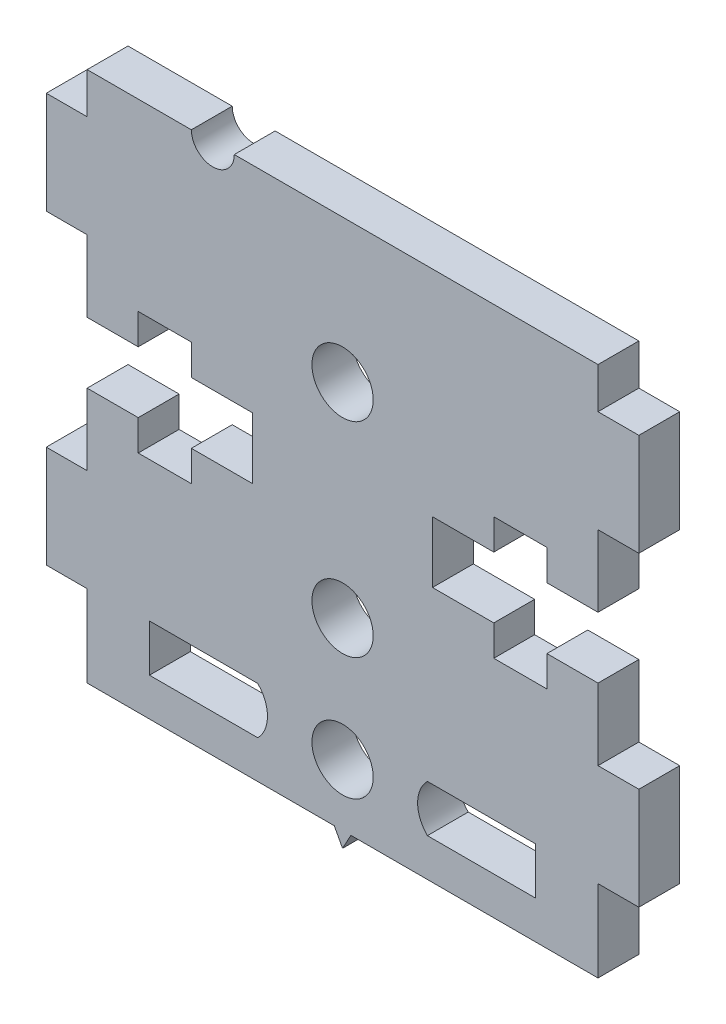
from build123d import *

# Parameters (mm, degrees)
SKETCH_1_R      = 1.5
EXTRUDE_1_DEPTH = 2


with BuildPart() as part:
    # 草图1 → 凸台-拉伸1 (new body)
    with BuildSketch(Plane.XY):
        with BuildLine():
            Line((-8.682938962, -11.200971973), (-10.682938962, -11.200971973))
            Line((-10.682938962, -11.200971973), (-10.682938962, -6.200971973))
            Line((-10.682938962, -6.200971973), (-8.682938962, -6.200971973))
            Line((-8.682938962, -6.200971973), (-8.682938962, -2.700971973))
            Line((-8.682938962, -2.700971973), (-6.182938962, -2.700971973))
            Line((-6.182938962, -2.700971973), (-6.182938962, -4.200971973))
            Line((-6.182938962, -4.200971973), (-3.582938962, -4.200971973))
            Line((-3.582938962, -4.200971973), (-3.582938962, -2.700971973))
            Line((-3.582938962, -2.700971973), (-0.582938962, -2.700971973))
            Line((-0.582938962, -2.700971973), (-0.582938962, 0.299028027))
            Line((-0.582938962, 0.299028027), (-3.582938962, 0.299028027))
            Line((-3.582938962, 0.299028027), (-3.582938962, 1.799028027))
            Line((-3.582938962, 1.799028027), (-6.182938962, 1.799028027))
            Line((-6.182938962, 1.799028027), (-6.182938962, 0.299028027))
            Line((-6.182938962, 0.299028027), (-8.682938962, 0.299028027))
            Line((-8.682938962, 0.299028027), (-8.682938962, 3.799028027))
            Line((-8.682938962, 3.799028027), (-10.682938962, 3.799028027))
            Line((-10.682938962, 3.799028027), (-10.682938962, 8.799028027))
            Line((-10.682938962, 8.799028027), (-8.682938962, 8.799028027))
            Line((-8.682938962, 8.799028027), (-8.682938962, 10.799028027))
            Line((-8.682938962, 10.799028027), (-3.582938962, 10.799028027))
            ThreePointArc((-3.582938962, 10.799028027), (-2.532938962, 9.749028027), (-1.482938962, 10.799028027))
            Line((-1.482938962, 10.799028027), (16.317061038, 10.799028027))
            Line((16.317061038, 10.799028027), (16.317061038, 8.799028027))
            Line((16.317061038, 8.799028027), (18.317061038, 8.799028027))
            Line((18.317061038, 8.799028027), (18.317061038, 3.799028027))
            Line((18.317061038, 3.799028027), (16.317061038, 3.799028027))
            Line((16.317061038, 3.799028027), (16.317061038, 0.299028027))
            Line((16.317061038, 0.299028027), (13.817061038, 0.299028027))
            Line((13.817061038, 0.299028027), (13.817061038, 1.799028027))
            Line((13.817061038, 1.799028027), (11.217061038, 1.799028027))
            Line((11.217061038, 1.799028027), (11.217061038, 0.299028027))
            Line((11.217061038, 0.299028027), (8.217061038, 0.299028027))
            Line((8.217061038, 0.299028027), (8.217061038, -2.700971973))
            Line((8.217061038, -2.700971973), (11.217061038, -2.700971973))
            Line((11.217061038, -2.700971973), (11.217061038, -4.200971973))
            Line((11.217061038, -4.200971973), (13.817061038, -4.200971973))
            Line((13.817061038, -4.200971973), (13.817061038, -2.700971973))
            Line((13.817061038, -2.700971973), (16.317061038, -2.700971973))
            Line((16.317061038, -2.700971973), (16.317061038, -6.200971973))
            Line((16.317061038, -6.200971973), (18.317061038, -6.200971973))
            Line((18.317061038, -6.200971973), (18.317061038, -11.200971973))
            Line((18.317061038, -11.200971973), (16.317061038, -11.200971973))
            Line((16.317061038, -11.200971973), (16.317061038, -15.200971973))
            Line((16.317061038, -15.200971973), (4.222987954, -15.200971973))
            Line((4.222987954, -15.200971973), (3.817061038, -15.955763704))
            Line((3.817061038, -15.955763704), (3.411134121, -15.200971973))
            Line((3.411134121, -15.200971973), (-8.682938962, -15.200971973))
            Line((-8.682938962, -15.200971973), (-8.682938962, -11.200971973))
        make_face()
        with Locations((3.817061038, -6.200971973)):
            Circle(SKETCH_1_R, mode=Mode.SUBTRACT)
        with Locations((3.817061038, 3.799028027)):
            Circle(SKETCH_1_R, mode=Mode.SUBTRACT)
        with Locations((3.817061038, -12.192801434)):
            Circle(SKETCH_1_R, mode=Mode.SUBTRACT)
        with BuildLine():
            Line((13.267061038, -13.342801434), (7.967061038, -13.342801434))
            ThreePointArc((7.967061038, -13.342801434), (7.490715441, -12.192801434), (7.967061038, -11.042801434))
            Line((7.967061038, -11.042801434), (13.267061038, -11.042801434))
            Line((13.267061038, -11.042801434), (13.267061038, -13.342801434))
        make_face(mode=Mode.SUBTRACT)
        with BuildLine():
            Line((-5.632938962, -11.042801434), (-0.332938962, -11.042801434))
            ThreePointArc((-0.332938962, -11.042801434), (0.143406634, -12.192801434), (-0.332938962, -13.342801434))
            Line((-0.332938962, -13.342801434), (-5.632938962, -13.342801434))
            Line((-5.632938962, -13.342801434), (-5.632938962, -11.042801434))
        make_face(mode=Mode.SUBTRACT)
    extrude(amount=EXTRUDE_1_DEPTH)


solid = part.part
